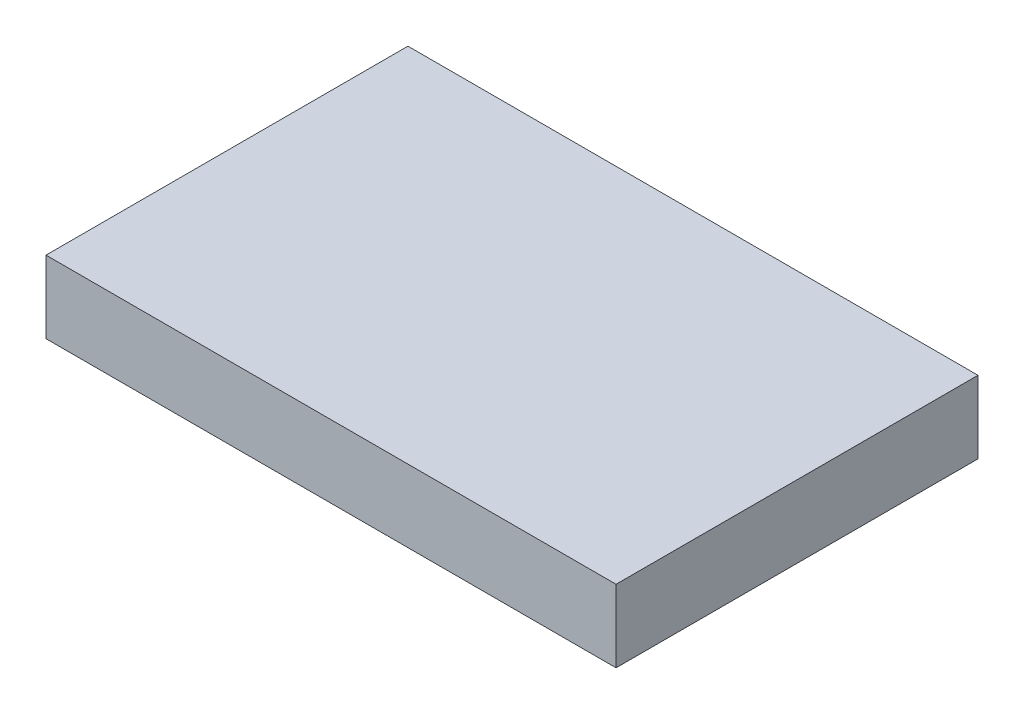
from build123d import *

# Parameters (mm, degrees)
SKETCH1_W           = 304.8
SKETCH1_H           = 304.8
BOSS_EXTRUDE1_DEPTH = 6.35
CUT_EXTRUDE2_DEPTH  = 6.35


with BuildPart() as part:
    # Sketch1 → Boss-Extrude1 (new body)
    with BuildSketch(Plane(origin=(0, 0, 0), x_dir=(1, 0, 0), z_dir=(0, 1, 0))):
        with Locations((152.4, 152.4)):
            Rectangle(SKETCH1_W, SKETCH1_H)
    extrude(amount=BOSS_EXTRUDE1_DEPTH)

    # Sketch2 → Cut-Extrude2 (cut)
    with BuildSketch(Plane(origin=(0, 6.35, 0), x_dir=(1, 0, 0), z_dir=(0, 1, 0))):
        Polygon((50.00625, 304.8), (50.00625, 273.05), (0, 273.05), (0, 0), (304.8, 0), (304.8, 304.8), align=None)
    extrude(amount=-CUT_EXTRUDE2_DEPTH, mode=Mode.SUBTRACT)


solid = part.part
